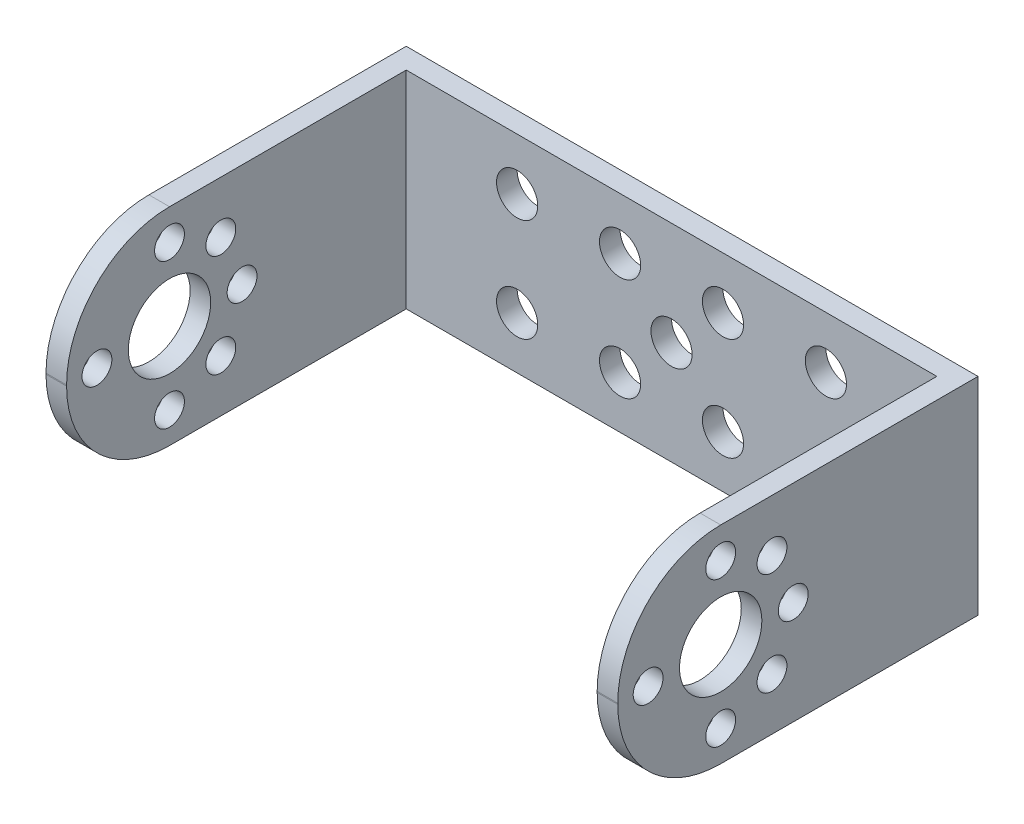
from build123d import *

# Parameters (mm, degrees)
CROQUIS1_W              = 55.55
CROQUIS1_H              = 20.1
SALIENTE_EXTRUIR1_DEPTH = 2
CROQUIS2_R              = 2
CORTAR_EXTRUIR1_DEPTH   = 30.604951022
CROQUIS3_W              = 2
CROQUIS3_H              = 20.1
SALIENTE_EXTRUIR2_DEPTH = 35
CORTAR_EXTRUIR2_REACH   = 68.421
CROQUIS4_R              = 4
CROQUIS4_R_2            = 1.45
REDONDEO4_R             = 10


with BuildPart() as part:
    # Croquis1 → Saliente-Extruir1 (new body)
    with BuildSketch(Plane.XY):
        Rectangle(CROQUIS1_W, CROQUIS1_H)
    extrude(amount=SALIENTE_EXTRUIR1_DEPTH)

    # Croquis2 → Cortar-Extruir1 (cut, through all)
    with BuildSketch(Plane.XY.offset(2)):
        Circle(CROQUIS2_R)
        with Locations((5, 5)):
            Circle(CROQUIS2_R)
        with Locations((5, -5)):
            Circle(CROQUIS2_R)
        with Locations(Location((-5, -5, 0), (0, 0, 180))):
            Circle(CROQUIS2_R)
        with Locations(Location((-5, 5, 0), (0, 0, 180))):
            Circle(CROQUIS2_R)
        with Locations((15, 5)):
            Circle(CROQUIS2_R)
        with Locations((15, -5)):
            Circle(CROQUIS2_R)
        with Locations(Location((-15, 5, 0), (0, 0, 180))):
            Circle(CROQUIS2_R)
        with Locations(Location((-15, -5, 0), (0, 0, 180))):
            Circle(CROQUIS2_R)
    extrude(amount=-CORTAR_EXTRUIR1_DEPTH, mode=Mode.SUBTRACT)

    # Croquis3 → Saliente-Extruir2 (add)
    with BuildSketch(Plane.XY):
        with Locations((-26.775, 0)):
            Rectangle(CROQUIS3_W, CROQUIS3_H)
        with Locations((26.775, 0)):
            Rectangle(CROQUIS3_W, CROQUIS3_H)
    extrude(amount=SALIENTE_EXTRUIR2_DEPTH)

    # Cortar-Extruir2: up to this face of the body (flat: up to its plane)
    cortar_extruir2_end = Plane(part.part.faces().sort_by_distance((-27.775, 0, 17.5))[0])
    # Croquis4 → Cortar-Extruir2 (cut, up to the picked face)
    with BuildSketch(Plane(origin=(27.775, 0, 0), x_dir=(0, 0, -1), z_dir=(1, 0, 0)), mode=Mode.PRIVATE) as cortar_extruir2_sk1:
        with Locations((-25, 0)):
            Circle(CROQUIS4_R)
    cortar_extruir2_tool1 = split(extrude(cortar_extruir2_sk1.sketch, amount=-CORTAR_EXTRUIR2_REACH, mode=Mode.PRIVATE), bisect_by=cortar_extruir2_end, keep=Keep.BOTH, mode=Mode.PRIVATE)
    # Croquis4 → Cortar-Extruir2 (cut, up to the picked face)
    with BuildSketch(Plane(origin=(27.775, 0, 0), x_dir=(0, 0, -1), z_dir=(1, 0, 0)), mode=Mode.PRIVATE) as cortar_extruir2_sk2:
        with Locations((-32.05, 0)):
            Circle(CROQUIS4_R_2)
    cortar_extruir2_tool2 = split(extrude(cortar_extruir2_sk2.sketch, amount=-CORTAR_EXTRUIR2_REACH, mode=Mode.PRIVATE), bisect_by=cortar_extruir2_end, keep=Keep.BOTH, mode=Mode.PRIVATE)
    # Croquis4 → Cortar-Extruir2 (cut, up to the picked face)
    with BuildSketch(Plane(origin=(27.775, 0, 0), x_dir=(0, 0, -1), z_dir=(1, 0, 0)), mode=Mode.PRIVATE) as cortar_extruir2_sk3:
        with Locations(Location((-17.95, 0, 0), (0, 0, 90))):
            Circle(CROQUIS4_R_2)
    cortar_extruir2_tool3 = split(extrude(cortar_extruir2_sk3.sketch, amount=-CORTAR_EXTRUIR2_REACH, mode=Mode.PRIVATE), bisect_by=cortar_extruir2_end, keep=Keep.BOTH, mode=Mode.PRIVATE)
    # Croquis4 → Cortar-Extruir2 (cut, up to the picked face)
    with BuildSketch(Plane(origin=(27.775, 0, 0), x_dir=(0, 0, -1), z_dir=(1, 0, 0)), mode=Mode.PRIVATE) as cortar_extruir2_sk4:
        with Locations(Location((-20.014897193, -4.985102807, 0), (0, 0, 90))):
            Circle(CROQUIS4_R_2)
    cortar_extruir2_tool4 = split(extrude(cortar_extruir2_sk4.sketch, amount=-CORTAR_EXTRUIR2_REACH, mode=Mode.PRIVATE), bisect_by=cortar_extruir2_end, keep=Keep.BOTH, mode=Mode.PRIVATE)
    # Croquis4 → Cortar-Extruir2 (cut, up to the picked face)
    with BuildSketch(Plane(origin=(27.775, 0, 0), x_dir=(0, 0, -1), z_dir=(1, 0, 0)), mode=Mode.PRIVATE) as cortar_extruir2_sk5:
        with Locations(Location((-25, -7.05, 0), (0, 0, 90))):
            Circle(CROQUIS4_R_2)
    cortar_extruir2_tool5 = split(extrude(cortar_extruir2_sk5.sketch, amount=-CORTAR_EXTRUIR2_REACH, mode=Mode.PRIVATE), bisect_by=cortar_extruir2_end, keep=Keep.BOTH, mode=Mode.PRIVATE)
    # Croquis4 → Cortar-Extruir2 (cut, up to the picked face)
    with BuildSketch(Plane(origin=(27.775, 0, 0), x_dir=(0, 0, -1), z_dir=(1, 0, 0)), mode=Mode.PRIVATE) as cortar_extruir2_sk6:
        with Locations((-25, 7.05)):
            Circle(CROQUIS4_R_2)
    cortar_extruir2_tool6 = split(extrude(cortar_extruir2_sk6.sketch, amount=-CORTAR_EXTRUIR2_REACH, mode=Mode.PRIVATE), bisect_by=cortar_extruir2_end, keep=Keep.BOTH, mode=Mode.PRIVATE)
    # Croquis4 → Cortar-Extruir2 (cut, up to the picked face)
    with BuildSketch(Plane(origin=(27.775, 0, 0), x_dir=(0, 0, -1), z_dir=(1, 0, 0)), mode=Mode.PRIVATE) as cortar_extruir2_sk7:
        with Locations((-20.014897193, 4.985102807)):
            Circle(CROQUIS4_R_2)
    cortar_extruir2_tool7 = split(extrude(cortar_extruir2_sk7.sketch, amount=-CORTAR_EXTRUIR2_REACH, mode=Mode.PRIVATE), bisect_by=cortar_extruir2_end, keep=Keep.BOTH, mode=Mode.PRIVATE)
    add(cortar_extruir2_tool1.solids().sort_by(Axis((27.775, 0, 25), (-1, 0, 0)))[0], mode=Mode.SUBTRACT)
    add(cortar_extruir2_tool2.solids().sort_by(Axis((27.775, 0, 32.05), (-1, 0, 0)))[0], mode=Mode.SUBTRACT)
    add(cortar_extruir2_tool3.solids().sort_by(Axis((27.775, 0, 17.95), (-1, 0, 0)))[0], mode=Mode.SUBTRACT)
    add(cortar_extruir2_tool4.solids().sort_by(Axis((27.775, -4.985103, 20.014897), (-1, 0, 0)))[0], mode=Mode.SUBTRACT)
    add(cortar_extruir2_tool5.solids().sort_by(Axis((27.775, -7.05, 25), (-1, 0, 0)))[0], mode=Mode.SUBTRACT)
    add(cortar_extruir2_tool6.solids().sort_by(Axis((27.775, 7.05, 25), (-1, 0, 0)))[0], mode=Mode.SUBTRACT)
    add(cortar_extruir2_tool7.solids().sort_by(Axis((27.775, 4.985103, 20.014897), (-1, 0, 0)))[0], mode=Mode.SUBTRACT)

    # Redondeo4
    redondeo4_edges = [part.edges().sort_by_distance(p)[0] for p in [
        (-26.775, -10.05, 35),
        (-26.775, 10.05, 35),
        (26.775, 10.05, 35),
        (26.775, -10.05, 35),
    ]]
    fillet(redondeo4_edges, radius=REDONDEO4_R)


solid = part.part
